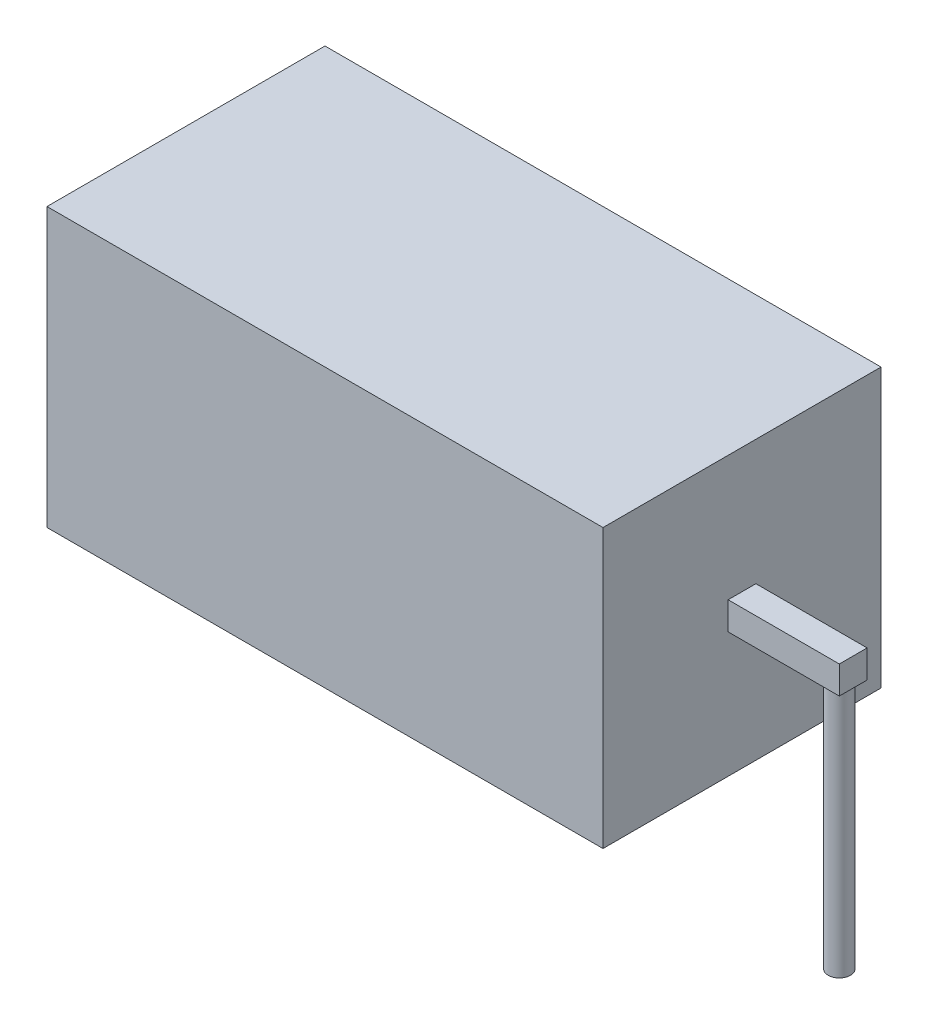
from build123d import *

# Parameters (mm, degrees)
SKETCH_1_W           = 20
SKETCH_1_H           = 10
EXTRUDE_1_DEPTH      = 10
EXTRUDE_2_DEPTH      = 4
EXTRUDE_2_DEPTH_BACK = 24
SKETCH_2_W           = 1
SKETCH_2_H           = 1
SKETCH_3_R           = 0.4
EXTRUDE_3_DEPTH      = 9


with BuildPart() as part:
    # Эскиз1 → Вытянуть1 (new body)
    with BuildSketch(Plane.XY):
        with Locations((10, 5)):
            Rectangle(SKETCH_1_W, SKETCH_1_H)
    extrude(amount=EXTRUDE_1_DEPTH)

    # Эскиз2 → Вытянуть2 (add, two sides: drawn at the far end of the back side and taken through both)
    with BuildSketch(Plane(origin=(20, 0, 0), x_dir=(0, 0, -1), z_dir=(1, 0, 0)).offset(-EXTRUDE_2_DEPTH_BACK)):
        with Locations((-5, 5)):
            Rectangle(SKETCH_2_W, SKETCH_2_H)
    extrude(amount=EXTRUDE_2_DEPTH + EXTRUDE_2_DEPTH_BACK)

    # Эскиз3 → Вытянуть3 (add)
    with BuildSketch(Plane.XZ.offset(-4.5)):
        with Locations(Location((-3.5, 5, 0), (0, 0, 90))):
            Circle(SKETCH_3_R)
        with Locations(Location((23.5, 5, 0), (0, 0, 90))):
            Circle(SKETCH_3_R)
    extrude(amount=EXTRUDE_3_DEPTH)


solid = part.part
